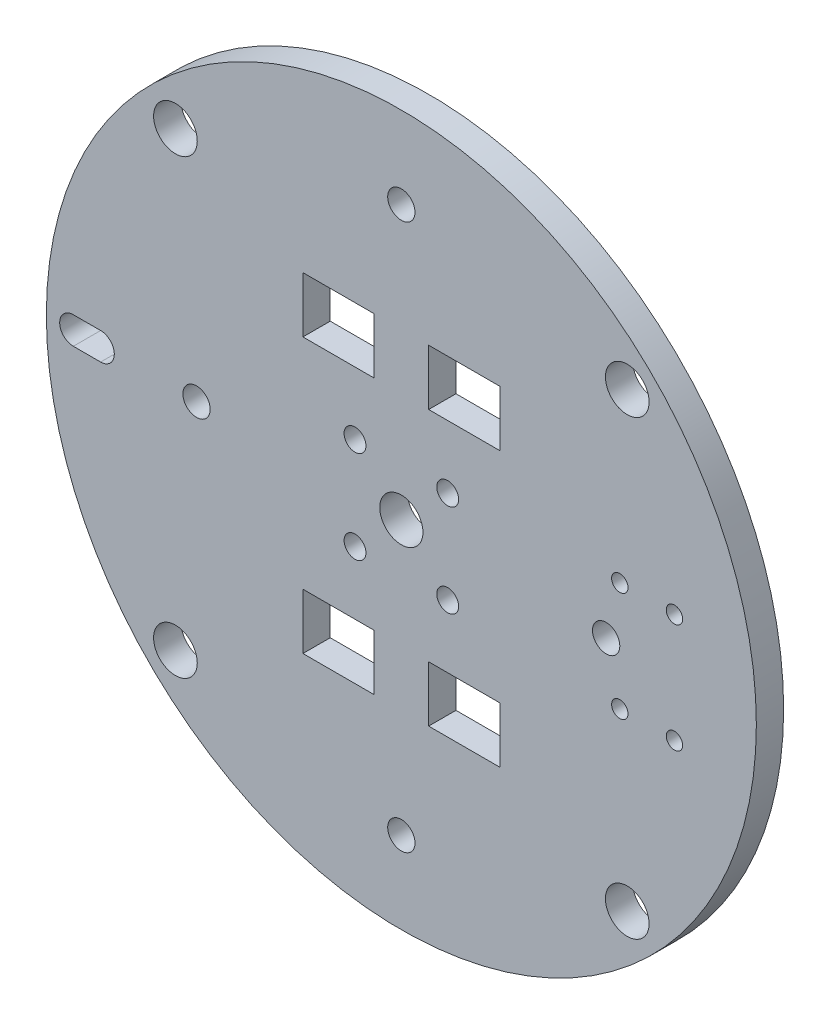
from build123d import *

# Parameters (mm, degrees)
SKETCH1_R           = 65
SKETCH1_R_2         = 2.5
SKETCH1_R_3         = 3.95
SKETCH1_R_4         = 1.5
SKETCH1_R_5         = 4
SKETCH1_R_6         = 2
SKETCH1_W           = 13.02
SKETCH1_H           = 10.2
BOSS_EXTRUDE1_DEPTH = 5


with BuildPart() as part:
    # Sketch1 → Boss-Extrude1 (new body)
    with BuildSketch(Plane.XY):
        Circle(SKETCH1_R)
        with Locations((-37.5, 0)):
            Circle(SKETCH1_R_2, mode=Mode.SUBTRACT)
        with Locations((37.5, 0)):
            Circle(SKETCH1_R_2, mode=Mode.SUBTRACT)
        with Locations((0, 50)):
            Circle(SKETCH1_R_2, mode=Mode.SUBTRACT)
        with Locations((0, -50)):
            Circle(SKETCH1_R_2, mode=Mode.SUBTRACT)
        Circle(SKETCH1_R_3, mode=Mode.SUBTRACT)
        with Locations((50, 10)):
            Circle(SKETCH1_R_4, mode=Mode.SUBTRACT)
        with Locations((50, -10)):
            Circle(SKETCH1_R_4, mode=Mode.SUBTRACT)
        with Locations((40, 10)):
            Circle(SKETCH1_R_4, mode=Mode.SUBTRACT)
        with Locations((40, -10)):
            Circle(SKETCH1_R_4, mode=Mode.SUBTRACT)
        with Locations((-41.365746699, 41.365746699)):
            Circle(SKETCH1_R_5, mode=Mode.SUBTRACT)
        with Locations((41.365746699, -41.365746699)):
            Circle(SKETCH1_R_5, mode=Mode.SUBTRACT)
        with Locations((41.365746699, 41.365746699)):
            Circle(SKETCH1_R_5, mode=Mode.SUBTRACT)
        with Locations((-41.365746699, -41.365746699)):
            Circle(SKETCH1_R_5, mode=Mode.SUBTRACT)
        with Locations((8.485281374, 8.485281374)):
            Circle(SKETCH1_R_6, mode=Mode.SUBTRACT)
        with Locations((8.485281374, -8.485281374)):
            Circle(SKETCH1_R_6, mode=Mode.SUBTRACT)
        with Locations((-8.485281374, -8.485281374)):
            Circle(SKETCH1_R_6, mode=Mode.SUBTRACT)
        with Locations((-8.485281374, 8.485281374)):
            Circle(SKETCH1_R_6, mode=Mode.SUBTRACT)
        with Locations((11.51, -25.1)):
            Rectangle(SKETCH1_W, SKETCH1_H, mode=Mode.SUBTRACT)
        with Locations((-11.51, -25.1)):
            Rectangle(SKETCH1_W, SKETCH1_H, mode=Mode.SUBTRACT)
        with Locations((-11.51, 25.1)):
            Rectangle(SKETCH1_W, SKETCH1_H, mode=Mode.SUBTRACT)
        with Locations((11.51, 25.1)):
            Rectangle(SKETCH1_W, SKETCH1_H, mode=Mode.SUBTRACT)
        with BuildLine():
            Line((-55.056563459, -2.5), (-60.056563459, -2.5))
            ThreePointArc((-60.056563459, -2.5), (-62.556563459, 0), (-60.056563459, 2.5))
            Line((-60.056563459, 2.5), (-55.056563459, 2.5))
            ThreePointArc((-55.056563459, 2.5), (-52.556563459, 0), (-55.056563459, -2.5))
        make_face(mode=Mode.SUBTRACT)
    extrude(amount=BOSS_EXTRUDE1_DEPTH)


solid = part.part
